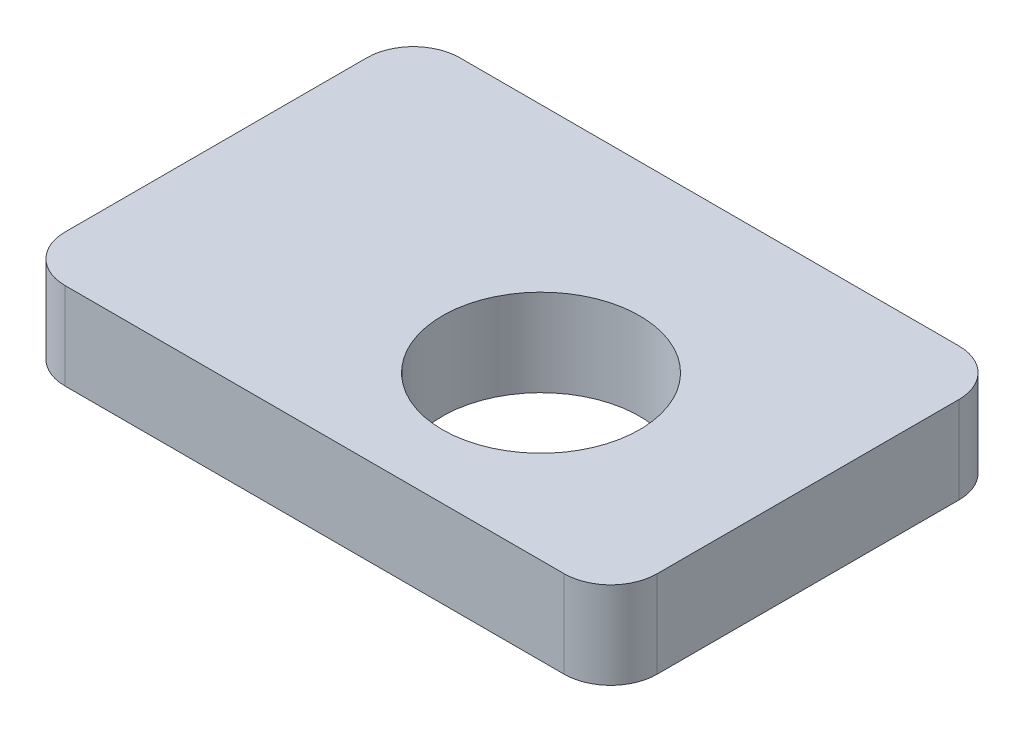
from build123d import *

# Parameters (mm, degrees)
SKETCH1_R           = 8.5
BOSS_EXTRUDE1_DEPTH = 7.5
FILLET1_R           = 4


with BuildPart() as part:
    # Sketch1 → Boss-Extrude1 (new body)
    with BuildSketch(Plane(origin=(0, 0, 0), x_dir=(1, 0, 0), z_dir=(0, 1, 0))):
        Polygon((-31, 0), (-31, 20), (20, 20), (20, 0), (20, -14), (-31, -14), align=None)
        with Locations(Location((0, 0, 0), (0, 0, 270))):
            Circle(SKETCH1_R, mode=Mode.SUBTRACT)
    extrude(amount=BOSS_EXTRUDE1_DEPTH)

    # Fillet1
    fillet1_edges = [part.edges().sort_by_distance(p)[0] for p in [
        (20, 3.75, 14),
        (-31, 3.75, 14),
        (-31, 3.75, -20),
        (20, 3.75, -20),
    ]]
    fillet(fillet1_edges, radius=FILLET1_R)


solid = part.part
